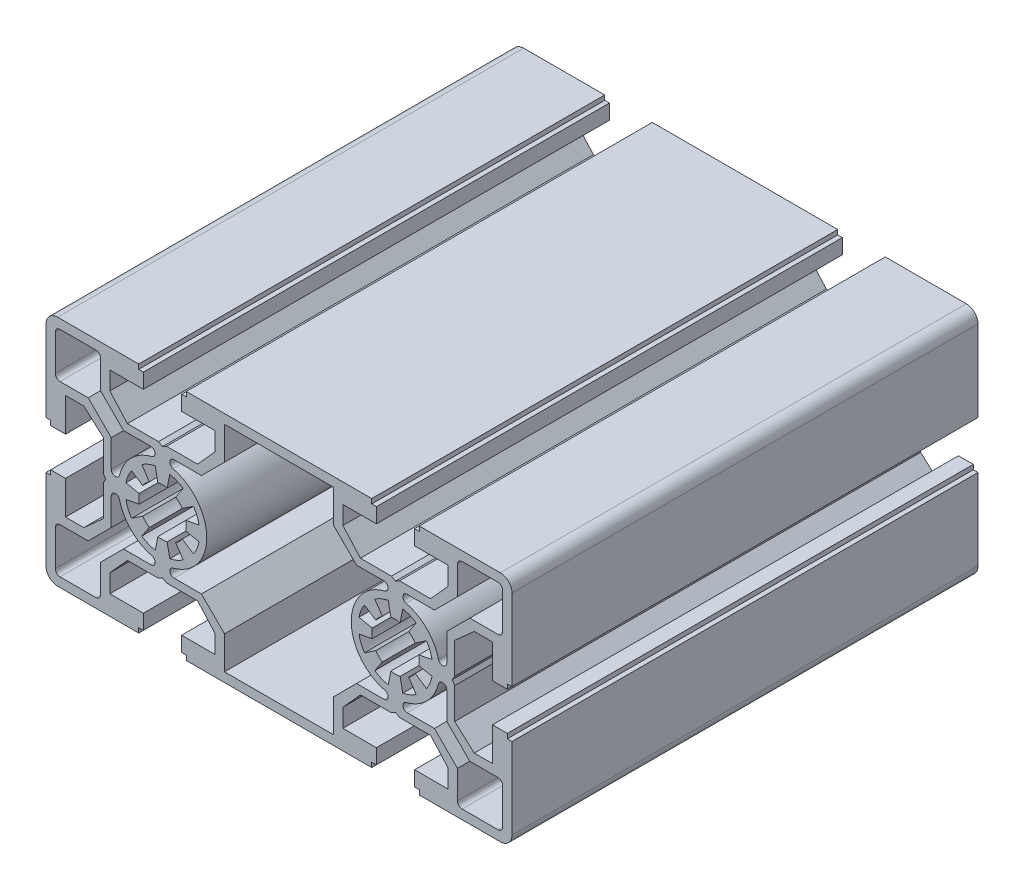
from build123d import *

# Parameters (mm, degrees)
EXTRUDE_1_DEPTH = 100


with BuildPart() as part:
    # 草图1 → 凸台-拉伸1 (new body)
    with BuildSketch(Plane.XY):
        with BuildLine():
            Line((75, 5.1), (75, 22.5))
            ThreePointArc((75, 22.5), (74.267766953, 24.267766953), (72.5, 25))
            Line((72.5, 25), (55.1, 25))
            Line((55.1, 25), (55.1, 24))
            Line((55.1, 24), (54.1, 24))
            Line((54.1, 24), (54.1, 20.8))
            Line((54.1, 20.8), (61.3, 20.8))
            Line((61.3, 20.8), (61.3, 16.889848481))
            Line((61.3, 16.889848481), (57.530151519, 12.7))
            Line((57.530151519, 12.7), (50.866025404, 12.7))
            Line((50.866025404, 12.7), (50, 12.2))
            Line((50, 12.2), (49.133974596, 12.7))
            Line((49.133974596, 12.7), (42.469848481, 12.7))
            Line((42.469848481, 12.7), (38.7, 16.889848481))
            Line((38.7, 16.889848481), (38.7, 20.8))
            Line((38.7, 20.8), (45.9, 20.8))
            Line((45.9, 20.8), (45.9, 24))
            Line((45.9, 24), (44.9, 24))
            Line((44.9, 24), (44.9, 25))
            Line((44.9, 25), (25, 25))
            Line((25, 25), (5.1, 25))
            Line((5.1, 25), (5.1, 24))
            Line((5.1, 24), (4.1, 24))
            Line((4.1, 24), (4.1, 20.8))
            Line((4.1, 20.8), (11.3, 20.8))
            Line((11.3, 20.8), (11.3, 16.889848481))
            Line((11.3, 16.889848481), (7.530151519, 12.7))
            Line((7.530151519, 12.7), (0.866025404, 12.7))
            Line((0.866025404, 12.7), (0, 12.2))
            Line((0, 12.2), (-0.866025404, 12.7))
            Line((-0.866025404, 12.7), (-7.530151519, 12.7))
            Line((-7.530151519, 12.7), (-11.3, 16.889848481))
            Line((-11.3, 16.889848481), (-11.3, 20.8))
            Line((-11.3, 20.8), (-4.1, 20.8))
            Line((-4.1, 20.8), (-4.1, 24))
            Line((-4.1, 24), (-5.1, 24))
            Line((-5.1, 24), (-5.1, 25))
            Line((-5.1, 25), (-22.5, 25))
            ThreePointArc((-22.5, 25), (-24.267766953, 24.267766953), (-25, 22.5))
            Line((-25, 22.5), (-25, 5.1))
            Line((-25, 5.1), (-24, 5.1))
            Line((-24, 5.1), (-24, 4.1))
            Line((-24, 4.1), (-20.8, 4.1))
            Line((-20.8, 4.1), (-20.8, 11.3))
            Line((-20.8, 11.3), (-16.889848481, 11.3))
            Line((-16.889848481, 11.3), (-12.7, 7.530151519))
            Line((-12.7, 7.530151519), (-12.7, 0.866025404))
            Line((-12.7, 0.866025404), (-12.2, 0))
            Line((-12.2, 0), (-12.7, -0.866025404))
            Line((-12.7, -0.866025404), (-12.7, -7.530151519))
            Line((-12.7, -7.530151519), (-16.889848481, -11.3))
            Line((-16.889848481, -11.3), (-20.8, -11.3))
            Line((-20.8, -11.3), (-20.8, -4.1))
            Line((-20.8, -4.1), (-24, -4.1))
            Line((-24, -4.1), (-24, -5.1))
            Line((-24, -5.1), (-25, -5.1))
            Line((-25, -5.1), (-25, -22.5))
            ThreePointArc((-25, -22.5), (-24.267766953, -24.267766953), (-22.5, -25))
            Line((-22.5, -25), (-5.1, -25))
            Line((-5.1, -25), (-5.1, -24))
            Line((-5.1, -24), (-4.1, -24))
            Line((-4.1, -24), (-4.1, -20.8))
            Line((-4.1, -20.8), (-11.3, -20.8))
            Line((-11.3, -20.8), (-11.3, -16.889848481))
            Line((-11.3, -16.889848481), (-7.530151519, -12.7))
            Line((-7.530151519, -12.7), (-0.866025404, -12.7))
            Line((-0.866025404, -12.7), (0, -12.2))
            Line((0, -12.2), (0.866025404, -12.7))
            Line((0.866025404, -12.7), (7.530151519, -12.7))
            Line((7.530151519, -12.7), (11.3, -16.889848481))
            Line((11.3, -16.889848481), (11.3, -20.8))
            Line((11.3, -20.8), (4.1, -20.8))
            Line((4.1, -20.8), (4.1, -24))
            Line((4.1, -24), (5.1, -24))
            Line((5.1, -24), (5.1, -25))
            Line((5.1, -25), (25, -25))
            Line((25, -25), (44.9, -25))
            Line((44.9, -25), (44.9, -24))
            Line((44.9, -24), (45.9, -24))
            Line((45.9, -24), (45.9, -20.8))
            Line((45.9, -20.8), (38.7, -20.8))
            Line((38.7, -20.8), (38.7, -16.889848481))
            Line((38.7, -16.889848481), (42.469848481, -12.7))
            Line((42.469848481, -12.7), (49.133974596, -12.7))
            Line((49.133974596, -12.7), (50, -12.2))
            Line((50, -12.2), (50.866025404, -12.7))
            Line((50.866025404, -12.7), (57.530151519, -12.7))
            Line((57.530151519, -12.7), (61.3, -16.889848481))
            Line((61.3, -16.889848481), (61.3, -20.8))
            Line((61.3, -20.8), (54.1, -20.8))
            Line((54.1, -20.8), (54.1, -24))
            Line((54.1, -24), (55.1, -24))
            Line((55.1, -24), (55.1, -25))
            Line((55.1, -25), (72.5, -25))
            ThreePointArc((72.5, -25), (74.267766953, -24.267766953), (75, -22.5))
            Line((75, -22.5), (75, -5.1))
            Line((75, -5.1), (74, -5.1))
            Line((74, -5.1), (74, -4.1))
            Line((74, -4.1), (70.8, -4.1))
            Line((70.8, -4.1), (70.8, -11.3))
            Line((70.8, -11.3), (66.889848481, -11.3))
            Line((66.889848481, -11.3), (62.7, -7.530151519))
            Line((62.7, -7.530151519), (62.7, -0.866025404))
            Line((62.7, -0.866025404), (62.2, 0))
            Line((62.2, 0), (62.7, 0.866025404))
            Line((62.7, 0.866025404), (62.7, 7.530151519))
            Line((62.7, 7.530151519), (66.889848481, 11.3))
            Line((66.889848481, 11.3), (70.8, 11.3))
            Line((70.8, 11.3), (70.8, 4.1))
            Line((70.8, 4.1), (74, 4.1))
            Line((74, 4.1), (74, 5.1))
            Line((74, 5.1), (75, 5.1))
        make_face()
        with BuildLine():
            Line((52.833408188, 4.240495023), (54.444561864, 6.651756898))
            ThreePointArc((54.444561864, 6.651756898), (53.061467459, 7.39103626), (51.560722576, 7.846282243))
            Line((51.560722576, 7.846282243), (50.994960642, 5.00200493))
            ThreePointArc((50.994960642, 5.00200493), (50, 5.1), (49.005039358, 5.00200493))
            Line((49.005039358, 5.00200493), (48.439277424, 7.846282243))
            ThreePointArc((48.439277424, 7.846282243), (46.938532541, 7.39103626), (45.555438136, 6.651756898))
            Line((45.555438136, 6.651756898), (47.166591812, 4.240495023))
            ThreePointArc((47.166591812, 4.240495023), (46.393755416, 3.606244584), (45.759504977, 2.833408188))
            Line((45.759504977, 2.833408188), (43.348243102, 4.444561864))
            ThreePointArc((43.348243102, 4.444561864), (42.60896374, 3.061467459), (42.153717757, 1.560722576))
            Line((42.153717757, 1.560722576), (44.99799507, 0.994960642))
            ThreePointArc((44.99799507, 0.994960642), (44.9, 0), (44.99799507, -0.994960642))
            Line((44.99799507, -0.994960642), (42.153717757, -1.560722576))
            ThreePointArc((42.153717757, -1.560722576), (42.60896374, -3.061467459), (43.348243102, -4.444561864))
            Line((43.348243102, -4.444561864), (45.759504977, -2.833408188))
            ThreePointArc((45.759504977, -2.833408188), (46.393755416, -3.606244584), (47.166591812, -4.240495023))
            Line((47.166591812, -4.240495023), (45.555438136, -6.651756898))
            ThreePointArc((45.555438136, -6.651756898), (46.938532541, -7.39103626), (48.439277424, -7.846282243))
            Line((48.439277424, -7.846282243), (49.005039358, -5.00200493))
            ThreePointArc((49.005039358, -5.00200493), (50, -5.1), (50.994960642, -5.00200493))
            Line((50.994960642, -5.00200493), (51.560722576, -7.846282243))
            ThreePointArc((51.560722576, -7.846282243), (53.061467459, -7.39103626), (54.444561864, -6.651756898))
            Line((54.444561864, -6.651756898), (52.833408188, -4.240495023))
            ThreePointArc((52.833408188, -4.240495023), (53.606244584, -3.606244584), (54.240495023, -2.833408188))
            Line((54.240495023, -2.833408188), (56.651756898, -4.444561864))
            ThreePointArc((56.651756898, -4.444561864), (57.39103626, -3.061467459), (57.846282243, -1.560722576))
            Line((57.846282243, -1.560722576), (55.00200493, -0.994960642))
            ThreePointArc((55.00200493, -0.994960642), (55.1, 0), (55.00200493, 0.994960642))
            Line((55.00200493, 0.994960642), (57.846282243, 1.560722576))
            ThreePointArc((57.846282243, 1.560722576), (57.39103626, 3.061467459), (56.651756898, 4.444561864))
            Line((56.651756898, 4.444561864), (54.240495023, 2.833408188))
            ThreePointArc((54.240495023, 2.833408188), (53.606244584, 3.606244584), (52.833408188, 4.240495023))
        make_face(mode=Mode.SUBTRACT)
        with BuildLine():
            Line((65.941421356, 13.3), (61, 8.358578644))
            Line((61, 8.358578644), (61, 2.479919354))
            ThreePointArc((61, 2.479919354), (60.208086504, 1.586433311), (59.225961538, 2.265310948))
            ThreePointArc((59.225961538, 2.265310948), (56.717514421, 6.717514421), (52.265310948, 9.225961538))
            ThreePointArc((52.265310948, 9.225961538), (51.586433311, 10.208086504), (52.479919354, 11))
            Line((52.479919354, 11), (58.358578644, 11))
            Line((58.358578644, 11), (63.3, 15.941421356))
            Line((63.3, 15.941421356), (63.3, 22))
            ThreePointArc((63.3, 22), (63.592893219, 22.707106781), (64.3, 23))
            Line((64.3, 23), (72, 23))
            ThreePointArc((72, 23), (72.707106781, 22.707106781), (73, 22))
            Line((73, 22), (73, 14.3))
            ThreePointArc((73, 14.3), (72.707106781, 13.592893219), (72, 13.3))
            Line((72, 13.3), (65.941421356, 13.3))
        make_face(mode=Mode.SUBTRACT)
        with BuildLine():
            Line((25, 23), (36.7, 23))
            Line((36.7, 23), (36.7, 15.941421356))
            Line((36.7, 15.941421356), (41.641421356, 11))
            Line((41.641421356, 11), (47.520080646, 11))
            ThreePointArc((47.520080646, 11), (48.413566689, 10.208086504), (47.734689052, 9.225961538))
            ThreePointArc((47.734689052, 9.225961538), (43.282485579, 6.717514421), (40.774038462, 2.265310948))
            ThreePointArc((40.774038462, 2.265310948), (41.8744433, -4.921923234), (47.734689052, -9.225961538))
            ThreePointArc((47.734689052, -9.225961538), (48.413566689, -10.208086504), (47.520080646, -11))
            Line((47.520080646, -11), (41.641421356, -11))
            Line((41.641421356, -11), (36.7, -15.941421356))
            Line((36.7, -15.941421356), (36.7, -23))
            Line((36.7, -23), (25, -23))
            Line((25, -23), (13.3, -23))
            Line((13.3, -23), (13.3, -15.941421356))
            Line((13.3, -15.941421356), (8.358578644, -11))
            Line((8.358578644, -11), (2.479919354, -11))
            ThreePointArc((2.479919354, -11), (1.586433311, -10.208086504), (2.265310948, -9.225961538))
            ThreePointArc((2.265310948, -9.225961538), (8.1255567, -4.921923234), (9.225961538, 2.265310948))
            ThreePointArc((9.225961538, 2.265310948), (6.717514421, 6.717514421), (2.265310948, 9.225961538))
            ThreePointArc((2.265310948, 9.225961538), (1.586433311, 10.208086504), (2.479919354, 11))
            Line((2.479919354, 11), (8.358578644, 11))
            Line((8.358578644, 11), (13.3, 15.941421356))
            Line((13.3, 15.941421356), (13.3, 23))
            Line((13.3, 23), (25, 23))
        make_face(mode=Mode.SUBTRACT)
        with BuildLine():
            Line((65.941421356, -13.3), (61, -8.358578644))
            Line((61, -8.358578644), (61, -2.479919354))
            ThreePointArc((61, -2.479919354), (60.208086504, -1.586433311), (59.225961538, -2.265310948))
            ThreePointArc((59.225961538, -2.265310948), (56.717514421, -6.717514421), (52.265310948, -9.225961538))
            ThreePointArc((52.265310948, -9.225961538), (51.586433311, -10.208086504), (52.479919354, -11))
            Line((52.479919354, -11), (58.358578644, -11))
            Line((58.358578644, -11), (63.3, -15.941421356))
            Line((63.3, -15.941421356), (63.3, -22))
            ThreePointArc((63.3, -22), (63.592893219, -22.707106781), (64.3, -23))
            Line((64.3, -23), (72, -23))
            ThreePointArc((72, -23), (72.707106781, -22.707106781), (73, -22))
            Line((73, -22), (73, -14.3))
            ThreePointArc((73, -14.3), (72.707106781, -13.592893219), (72, -13.3))
            Line((72, -13.3), (65.941421356, -13.3))
        make_face(mode=Mode.SUBTRACT)
        with BuildLine():
            Line((-4.240495023, 2.833408188), (-6.651756898, 4.444561864))
            ThreePointArc((-6.651756898, 4.444561864), (-7.39103626, 3.061467459), (-7.846282243, 1.560722576))
            Line((-7.846282243, 1.560722576), (-5.00200493, 0.994960642))
            ThreePointArc((-5.00200493, 0.994960642), (-5.1, 0), (-5.00200493, -0.994960642))
            Line((-5.00200493, -0.994960642), (-7.846282243, -1.560722576))
            ThreePointArc((-7.846282243, -1.560722576), (-7.39103626, -3.061467459), (-6.651756898, -4.444561864))
            Line((-6.651756898, -4.444561864), (-4.240495023, -2.833408188))
            ThreePointArc((-4.240495023, -2.833408188), (-3.606244584, -3.606244584), (-2.833408188, -4.240495023))
            Line((-2.833408188, -4.240495023), (-4.444561864, -6.651756898))
            ThreePointArc((-4.444561864, -6.651756898), (-3.061467459, -7.39103626), (-1.560722576, -7.846282243))
            Line((-1.560722576, -7.846282243), (-0.994960642, -5.00200493))
            ThreePointArc((-0.994960642, -5.00200493), (0, -5.1), (0.994960642, -5.00200493))
            Line((0.994960642, -5.00200493), (1.560722576, -7.846282243))
            ThreePointArc((1.560722576, -7.846282243), (3.061467459, -7.39103626), (4.444561864, -6.651756898))
            Line((4.444561864, -6.651756898), (2.833408188, -4.240495023))
            ThreePointArc((2.833408188, -4.240495023), (3.606244584, -3.606244584), (4.240495023, -2.833408188))
            Line((4.240495023, -2.833408188), (6.651756898, -4.444561864))
            ThreePointArc((6.651756898, -4.444561864), (7.39103626, -3.061467459), (7.846282243, -1.560722576))
            Line((7.846282243, -1.560722576), (5.00200493, -0.994960642))
            ThreePointArc((5.00200493, -0.994960642), (5.1, 0), (5.00200493, 0.994960642))
            Line((5.00200493, 0.994960642), (7.846282243, 1.560722576))
            ThreePointArc((7.846282243, 1.560722576), (7.39103626, 3.061467459), (6.651756898, 4.444561864))
            Line((6.651756898, 4.444561864), (4.240495023, 2.833408188))
            ThreePointArc((4.240495023, 2.833408188), (3.606244584, 3.606244584), (2.833408188, 4.240495023))
            Line((2.833408188, 4.240495023), (4.444561864, 6.651756898))
            ThreePointArc((4.444561864, 6.651756898), (3.061467459, 7.39103626), (1.560722576, 7.846282243))
            Line((1.560722576, 7.846282243), (0.994960642, 5.00200493))
            ThreePointArc((0.994960642, 5.00200493), (0, 5.1), (-0.994960642, 5.00200493))
            Line((-0.994960642, 5.00200493), (-1.560722576, 7.846282243))
            ThreePointArc((-1.560722576, 7.846282243), (-3.061467459, 7.39103626), (-4.444561864, 6.651756898))
            Line((-4.444561864, 6.651756898), (-2.833408188, 4.240495023))
            ThreePointArc((-2.833408188, 4.240495023), (-3.606244584, 3.606244584), (-4.240495023, 2.833408188))
        make_face(mode=Mode.SUBTRACT)
        with BuildLine():
            Line((-15.941421356, 13.3), (-11, 8.358578644))
            Line((-11, 8.358578644), (-11, 2.479919354))
            ThreePointArc((-11, 2.479919354), (-10.208086504, 1.586433311), (-9.225961538, 2.265310948))
            ThreePointArc((-9.225961538, 2.265310948), (-6.717514421, 6.717514421), (-2.265310948, 9.225961538))
            ThreePointArc((-2.265310948, 9.225961538), (-1.586433311, 10.208086504), (-2.479919354, 11))
            Line((-2.479919354, 11), (-8.358578644, 11))
            Line((-8.358578644, 11), (-13.3, 15.941421356))
            Line((-13.3, 15.941421356), (-13.3, 22))
            ThreePointArc((-13.3, 22), (-13.592893219, 22.707106781), (-14.3, 23))
            Line((-14.3, 23), (-22, 23))
            ThreePointArc((-22, 23), (-22.707106781, 22.707106781), (-23, 22))
            Line((-23, 22), (-23, 14.3))
            ThreePointArc((-23, 14.3), (-22.707106781, 13.592893219), (-22, 13.3))
            Line((-22, 13.3), (-15.941421356, 13.3))
        make_face(mode=Mode.SUBTRACT)
        with BuildLine():
            Line((-15.941421356, -13.3), (-11, -8.358578644))
            Line((-11, -8.358578644), (-11, -2.479919354))
            ThreePointArc((-11, -2.479919354), (-10.208086504, -1.586433311), (-9.225961538, -2.265310948))
            ThreePointArc((-9.225961538, -2.265310948), (-6.717514421, -6.717514421), (-2.265310948, -9.225961538))
            ThreePointArc((-2.265310948, -9.225961538), (-1.586433311, -10.208086504), (-2.479919354, -11))
            Line((-2.479919354, -11), (-8.358578644, -11))
            Line((-8.358578644, -11), (-13.3, -15.941421356))
            Line((-13.3, -15.941421356), (-13.3, -22))
            ThreePointArc((-13.3, -22), (-13.592893219, -22.707106781), (-14.3, -23))
            Line((-14.3, -23), (-22, -23))
            ThreePointArc((-22, -23), (-22.707106781, -22.707106781), (-23, -22))
            Line((-23, -22), (-23, -14.3))
            ThreePointArc((-23, -14.3), (-22.707106781, -13.592893219), (-22, -13.3))
            Line((-22, -13.3), (-15.941421356, -13.3))
        make_face(mode=Mode.SUBTRACT)
    extrude(amount=EXTRUDE_1_DEPTH)


solid = part.part
